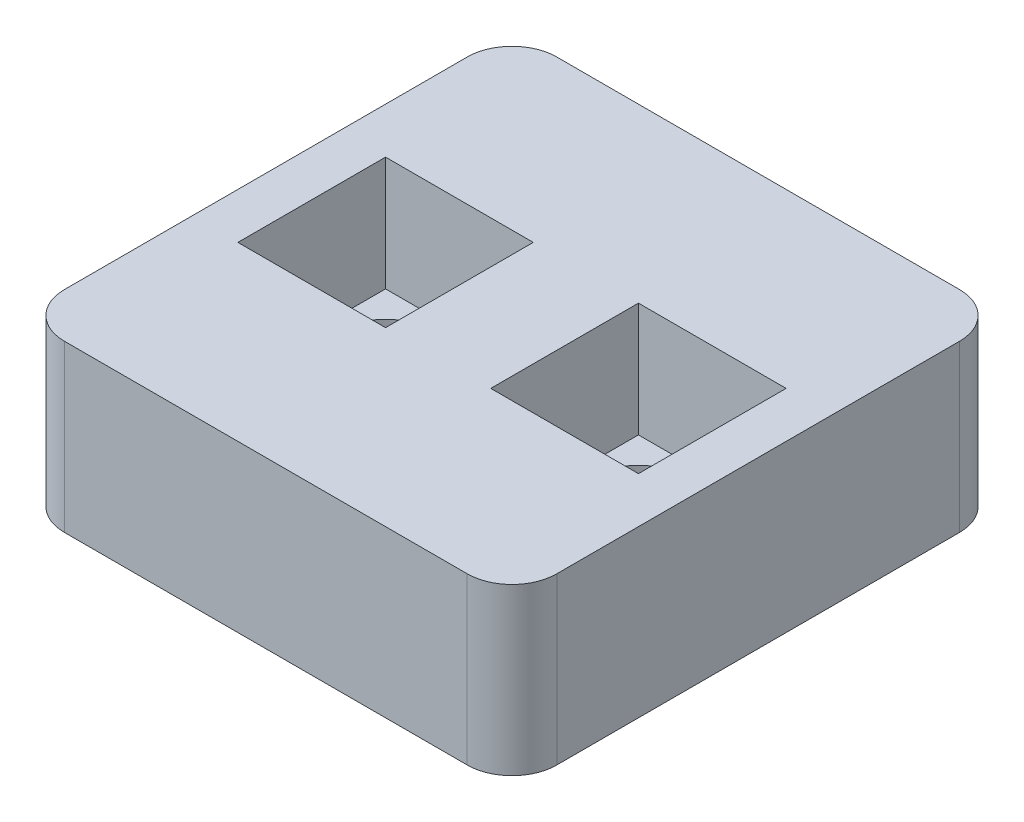
from build123d import *

# Parameters (mm, degrees)
SKETCH1_W           = 11
SKETCH1_H           = 11
BOSS_EXTRUDE1_DEPTH = 3.7
FILLET1_R           = 1
SKETCH2_W           = 3.3
SKETCH2_H           = 3.3
CUT_EXTRUDE1_DEPTH  = 2.55
SKETCH3_R           = 1.5
CUT_EXTRUDE2_DEPTH  = 9.613361713


with BuildPart() as part:
    # Sketch1 → Boss-Extrude1 (new body)
    with BuildSketch(Plane(origin=(0, 0, 0), x_dir=(1, 0, 0), z_dir=(0, 1, 0))):
        Rectangle(SKETCH1_W, SKETCH1_H)
    extrude(amount=BOSS_EXTRUDE1_DEPTH)

    # Fillet1
    fillet1_edges = [part.edges().sort_by_distance(p)[0] for p in [
        (5.5, 1.85, 5.5),
        (-5.5, 1.85, 5.5),
        (-5.5, 1.85, -5.5),
        (5.5, 1.85, -5.5),
    ]]
    fillet(fillet1_edges, radius=FILLET1_R)

    # Sketch2 → Cut-Extrude1 (cut)
    with BuildSketch(Plane(origin=(0, 3.7, 0), x_dir=(1, 0, 0), z_dir=(0, 1, 0))):
        with Locations((-2.825, 0)):
            Rectangle(SKETCH2_W, SKETCH2_H)
        with Locations((2.825, 0)):
            Rectangle(SKETCH2_W, SKETCH2_H)
    extrude(amount=-CUT_EXTRUDE1_DEPTH, mode=Mode.SUBTRACT)

    # Sketch3 → Cut-Extrude2 (cut, through all)
    with BuildSketch(Plane(origin=(0, 3.7, 0), x_dir=(1, 0, 0), z_dir=(0, 1, 0))):
        with Locations(Location((-2.825, 0, 0), (0, 0, 270))):
            Circle(SKETCH3_R)
        with Locations(Location((2.825, 0, 0), (0, 0, 270))):
            Circle(SKETCH3_R)
    extrude(amount=-CUT_EXTRUDE2_DEPTH, mode=Mode.SUBTRACT)


solid = part.part
